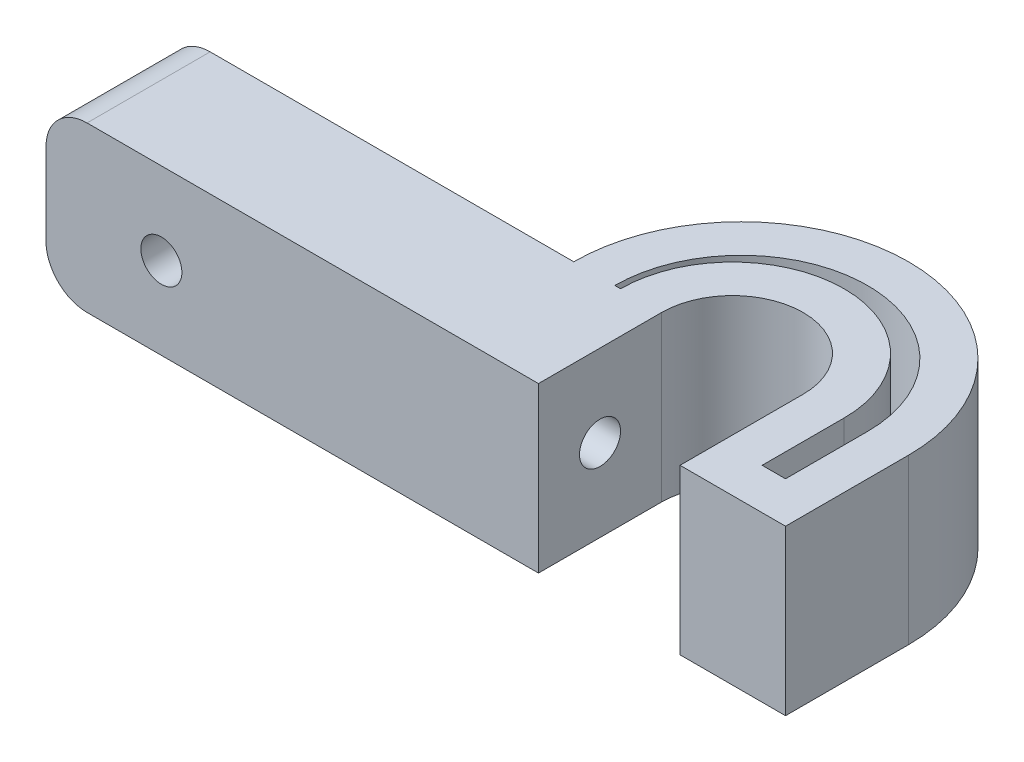
from build123d import *

# Parameters (mm, degrees)
BOSS_EXTRU_1_DEPTH      = 30
ESQUISSE3_R             = 5
ENL_V_MAT_EXTRU_1_DEPTH = 40
ESQUISSE4_R             = 5
ENL_V_MAT_EXTRU_2_DEPTH = 30
EXTRU_MINCE1_DEPTH      = 20


with BuildPart() as part:
    # Esquisse1 → Boss.-Extru.1 (new body)
    with BuildSketch(Plane.XY):
        with BuildLine():
            Line((-50, -20), (60, -20))
            Line((60, -20), (60, 20))
            Line((60, 20), (-50, 20))
            ThreePointArc((-50, 20), (-57.071067812, 17.071067812), (-60, 10))
            Line((-60, 10), (-60, -10))
            ThreePointArc((-60, -10), (-57.071067812, -17.071067812), (-50, -20))
        make_face()
    extrude(amount=BOSS_EXTRU_1_DEPTH)

    # Esquisse3 → Enlèv. mat.-Extru.1 (cut)
    with BuildSketch(Plane(origin=(0, 0, 0), x_dir=(-1, 0, 0), z_dir=(0, 0, -1))):
        with Locations((31.886780036, 0)):
            Circle(ESQUISSE3_R)
    extrude(amount=-ENL_V_MAT_EXTRU_1_DEPTH, mode=Mode.SUBTRACT)

    # Esquisse4 → Enlèv. mat.-Extru.2 (cut)
    with BuildSketch(Plane(origin=(60, 0, 0), x_dir=(0, 0, -1), z_dir=(1, 0, 0))):
        with Locations((-15, 0)):
            Circle(ESQUISSE4_R)
    extrude(amount=-ENL_V_MAT_EXTRU_2_DEPTH, mode=Mode.SUBTRACT)

    # Esquisse11 → Extru.-Mince1 (add, symmetric)
    with BuildSketch(Plane(origin=(0, 0, 0), x_dir=(-1, 0, 0), z_dir=(0, -1, 0))):
        with BuildLine():
            ThreePointArc((-60, 0), (-77.250281864, 17.250281864), (-94.500563727, 0))
            Line((-94.500563727, 0), (-94.500563727, -30))
            Line((-94.500563727, -30), (-120.200563727, -30))
            Line((-120.200563727, -30), (-120.200563727, 0))
            ThreePointArc((-120.200563727, 0), (-79.40232614, 40.798237588), (-38.604088552, 0))
            Line((-38.604088552, 0), (-48.604088552, 0))
            ThreePointArc((-48.604088552, 0), (-79.40232614, 30.798237588), (-110.200563727, 0))
            Line((-110.200563727, 0), (-110.200563727, -20))
            Line((-110.200563727, -20), (-104.500563727, -20))
            Line((-104.500563727, -20), (-104.500563727, 0))
            ThreePointArc((-104.500563727, 0), (-77.250281864, 27.250281864), (-50, 0))
            Line((-50, 0), (-60, 0))
        make_face()
    extrude(amount=EXTRU_MINCE1_DEPTH, both=True)


solid = part.part
